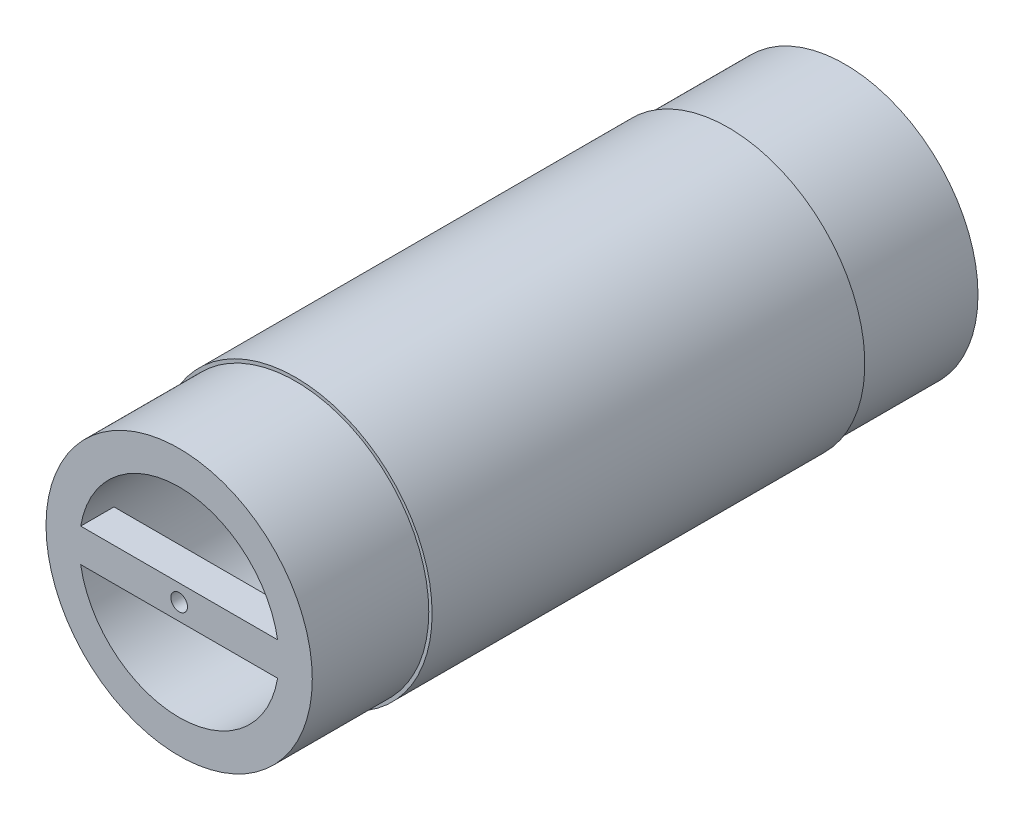
from build123d import *
from build123d.topology import SkipClean

# Parameters (mm, degrees)
SKETCH1_R               = 40
BOSS_EXTRUDE1_DEPTH     = 100
CUT_EXTRUDE1_START      = -10
CUT_EXTRUDE1_DEPTH      = 180
CUT_EXTRUDE2_DEPTH      = 208.846096908
CUT_EXTRUDE2_DEPTH_BACK = 208.846096908
SKETCH3_R               = 2.5
BOSS_EXTRUDE2_START     = -165
SKETCH4_R               = 41
SKETCH4_R_2             = 40
BOSS_EXTRUDE2_DEPTH     = 130
SCALE1_SCALE            = 1.1


with BuildPart() as part:
    # Sketch1 → Boss-Extrude1 (new, symmetric)
    with BuildSketch(Plane.XY):
        Circle(SKETCH1_R)
        with BuildLine():
            Line((29.580398915, 5), (-29.580398915, 5))
            ThreePointArc((-29.580398915, 5), (0, 30), (29.580398915, 5))
        make_face(mode=Mode.SUBTRACT)
        with BuildLine():
            Line((29.580398915, -5), (-29.580398915, -5))
            ThreePointArc((-29.580398915, -5), (0, -30), (29.580398915, -5))
        make_face(mode=Mode.SUBTRACT)
    extrude(amount=BOSS_EXTRUDE1_DEPTH, both=True)

    # Sketch2 → Cut-Extrude1 (cut)
    with BuildSketch(Plane.XY.offset(100).offset(CUT_EXTRUDE1_START)):
        with BuildLine():
            Line((-29.580398915, 5), (29.580398915, 5))
            ThreePointArc((29.580398915, 5), (30, 0), (29.580398915, -5))
            Line((29.580398915, -5), (-29.580398915, -5))
            ThreePointArc((-29.580398915, -5), (-30, 0), (-29.580398915, 5))
        make_face()
    extrude(amount=-CUT_EXTRUDE1_DEPTH, mode=Mode.SUBTRACT)

    # Sketch3 → Cut-Extrude2 (cut, two sides: drawn at the far end of the back side and taken through both)
    with SkipClean():  # the faces are left unmerged after this step: merging them gives an invalid solid
        with BuildSketch(Plane.XY.offset(100).offset(-CUT_EXTRUDE2_DEPTH_BACK)):
            Circle(SKETCH3_R)
        extrude(amount=CUT_EXTRUDE2_DEPTH + CUT_EXTRUDE2_DEPTH_BACK, mode=Mode.SUBTRACT)

    # Sketch4 → Boss-Extrude2 (add)
    with SkipClean():  # the faces are left unmerged after this step: merging them gives an invalid solid
        with BuildSketch(Plane(origin=(0, 0, -100), x_dir=(-1, 0, 0), z_dir=(0, 0, -1)).offset(BOSS_EXTRUDE2_START)):
            Circle(SKETCH4_R)
            Circle(SKETCH4_R_2, mode=Mode.SUBTRACT)
        extrude(amount=BOSS_EXTRUDE2_DEPTH)


with BuildPart() as part_1:
    # Scale1: scaled about (0, 0, 0)
    add(part.part.scale(SCALE1_SCALE))


solid = part_1.part
